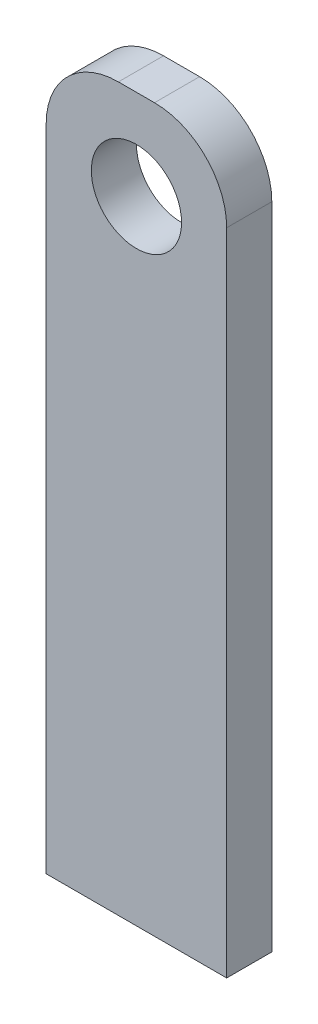
from build123d import *

# Parameters (mm, degrees)
SKETCH1_W                       = 12.7
SKETCH1_H                       = 50.8
EXTRUDE1_DEPTH                  = 3.175
F_1_4_0_25_DIAMETER_HOLE1_D     = 6.35
F_1_4_0_25_DIAMETER_HOLE1_DEPTH = 6.35
F_1_4_0_25_DIAMETER_HOLE1_TIP   = 1.907732465
FILLET1_R                       = 5.08


with BuildPart() as part:
    # Sketch1 → Extrude1 (new body)
    with BuildSketch(Plane.XY):
        Rectangle(SKETCH1_W, SKETCH1_H)
    extrude(amount=EXTRUDE1_DEPTH)

    # 1/4 (0.25) Diameter Hole1
    with Locations(Plane(origin=(0, 19.05, 3.175), x_dir=(1, 0, 0), z_dir=(0, 0, 1))):
        with Locations((0, 0)):
            Hole(F_1_4_0_25_DIAMETER_HOLE1_D / 2, depth=F_1_4_0_25_DIAMETER_HOLE1_DEPTH)
            with Locations((0, 0, -(F_1_4_0_25_DIAMETER_HOLE1_DEPTH + F_1_4_0_25_DIAMETER_HOLE1_TIP / 2))):  # 118° drill point
                Cone(0, F_1_4_0_25_DIAMETER_HOLE1_D / 2, F_1_4_0_25_DIAMETER_HOLE1_TIP, mode=Mode.SUBTRACT)

    # Fillet1
    fillet1_edges = [part.edges().sort_by_distance(p)[0] for p in [
        (-6.35, 25.4, 1.5875),
        (6.35, 25.4, 1.5875),
    ]]
    fillet(fillet1_edges, radius=FILLET1_R)


solid = part.part
